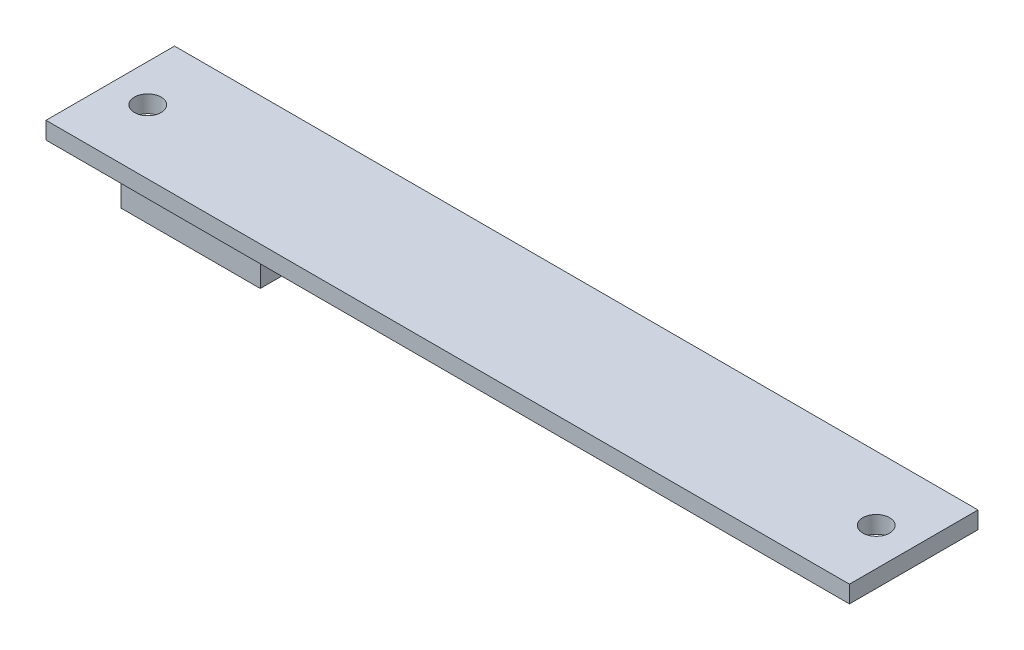
from build123d import *

# Parameters (mm, degrees)
SKETCH1_W           = 75
SKETCH1_H           = 12
PCB_DEPTH           = 1.6
SKETCH2_R           = 1.25
SCREW_HOLES_DEPTH   = 76.970783858
SKETCH3_W           = 13
SKETCH3_H           = 2.3
BOSS_EXTRUDE1_DEPTH = 3


with BuildPart() as part:
    # Sketch1 → pcb (new body)
    with BuildSketch(Plane(origin=(0, 0, 0), x_dir=(1, 0, 0), z_dir=(0, 1, 0))):
        with Locations((-37.5, 6)):
            Rectangle(SKETCH1_W, SKETCH1_H)
    extrude(amount=PCB_DEPTH)

    # Sketch2 → screw holes (cut, through all)
    with BuildSketch(Plane(origin=(0, 1.6, 0), x_dir=(1, 0, 0), z_dir=(0, 1, 0))):
        with Locations(Location((-71.5, 6, 0), (0, 0, 270))):
            Circle(SKETCH2_R)
        with Locations(Location((-3.5, 6, 0), (0, 0, 270))):
            Circle(SKETCH2_R)
    extrude(amount=-SCREW_HOLES_DEPTH, mode=Mode.SUBTRACT)

    # Sketch3 → Boss-Extrude1 (add)
    with BuildSketch(Plane.XZ):
        with Locations((-62.5, -2.15)):
            Rectangle(SKETCH3_W, SKETCH3_H)
    extrude(amount=BOSS_EXTRUDE1_DEPTH)


solid = part.part
